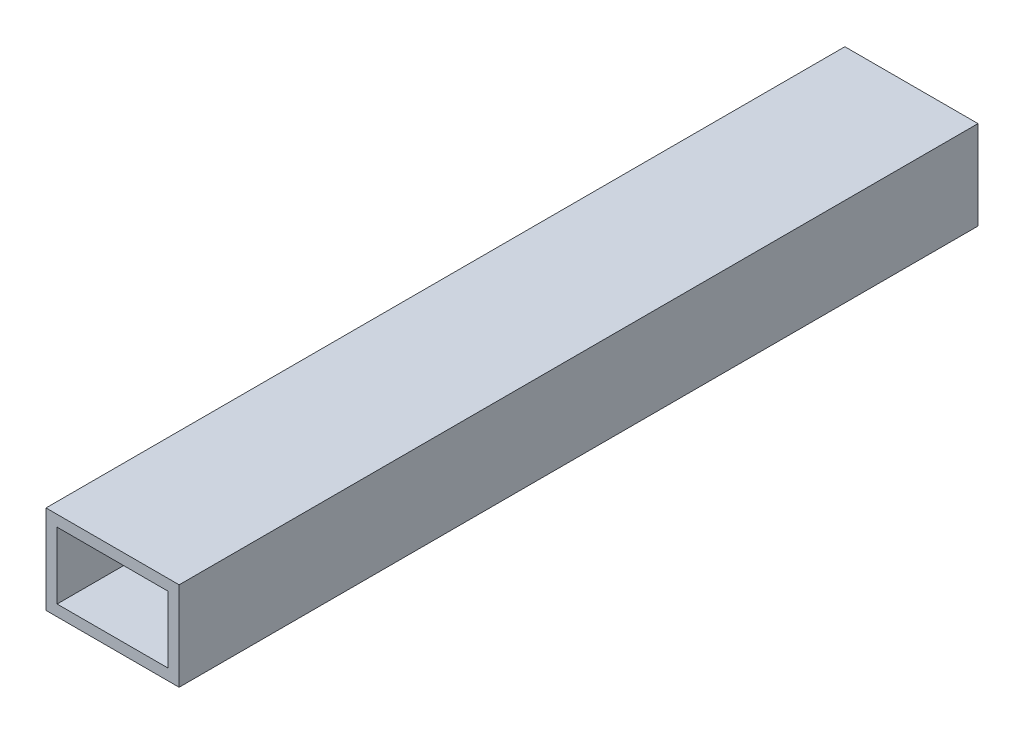
from build123d import *

# Parameters (mm, degrees)
BOSS_EXTRUDE1_DEPTH      = 114.3
BOSS_EXTRUDE1_DEPTH_BACK = 114.3
SKETCH3_W                = 38.1
SKETCH3_H                = 25.4
SKETCH3_W_2              = 31.75
SKETCH3_H_2              = 19.05


with BuildPart() as part:
    # Sketch3 → Boss-Extrude1 (new, two sides: drawn at the far end of the back side and taken through both)
    with BuildSketch(Plane.XY.offset(-BOSS_EXTRUDE1_DEPTH_BACK)):
        Rectangle(SKETCH3_W, SKETCH3_H)
        Rectangle(SKETCH3_W_2, SKETCH3_H_2, mode=Mode.SUBTRACT)
    extrude(amount=BOSS_EXTRUDE1_DEPTH + BOSS_EXTRUDE1_DEPTH_BACK)


solid = part.part
